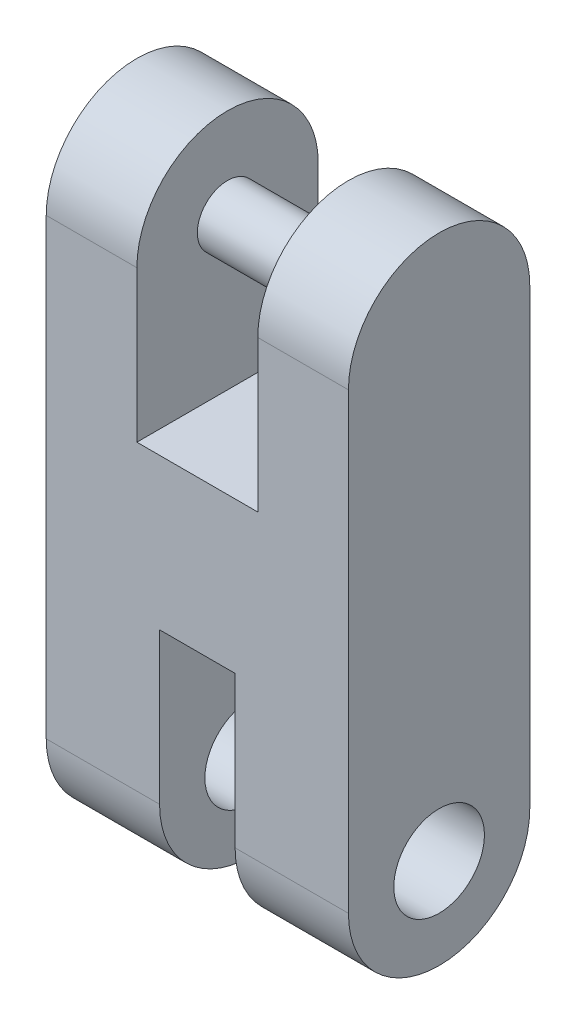
from build123d import *

# Parameters (mm, degrees)
SALIENTE_EXTRUIR1_DEPTH = 6
REDONDEO1_RADIUS        = 3
REDONDEO1_LENGTH        = 3.75
REDONDEO2_RADIUS        = 3
REDONDEO2_LENGTH        = 3
REDONDEO3_RADIUS        = 3
REDONDEO3_LENGTH        = 3
REDONDEO4_RADIUS        = 3
REDONDEO4_LENGTH        = 3.75
CORTAR_EXTRUIR1_REACH   = 26.021
CROQUIS2_R              = 1.5
CROQUIS2_R_2            = 1
SALIENTE_EXTRUIR3_START = -10
CROQUIS6_R              = 1
SALIENTE_EXTRUIR3_DEPTH = 10


with BuildPart() as part:
    # Croquis1 → Saliente-Extruir1 (new body)
    with BuildSketch(Plane.XY):
        Polygon((-7, 21), (-7, 13), (-3, 13), (-3, 21), (0, 21), (0, 0), (-3.75, 0), (-3.75, 8), (-6.25, 8), (-6.25, 0), (-10, 0), (-10, 21), align=None)
    extrude(amount=SALIENTE_EXTRUIR1_DEPTH)

    # Redondeo1: full round fillet: the end face becomes a half cylinder, R = half its width
    redondeo1_face = Plane((-1.875, 0, 3), x_dir=(1, 0, 0), z_dir=(0, -1, 0))  # on the end face: x along it, z out of the body
    redondeo1_slab = redondeo1_face.offset(-REDONDEO1_RADIUS / 2) * Box(REDONDEO1_LENGTH, 2 * REDONDEO1_RADIUS, REDONDEO1_RADIUS, mode=Mode.PRIVATE)  # the body's end, R deep
    redondeo1_round = Plane((-1.875, 3, 3), x_dir=(0, -1, 0), z_dir=(1, 0, 0)) * Cylinder(REDONDEO1_RADIUS, REDONDEO1_LENGTH, mode=Mode.PRIVATE)  # its axis R under the face
    add(redondeo1_slab - redondeo1_round, mode=Mode.SUBTRACT)

    # Redondeo2: full round fillet: the end face becomes a half cylinder, R = half its width
    redondeo2_face = Plane((-1.5, 21, 3), x_dir=(-1, 0, 0), z_dir=(0, 1, 0))  # on the end face: x along it, z out of the body
    redondeo2_slab = redondeo2_face.offset(-REDONDEO2_RADIUS / 2) * Box(REDONDEO2_LENGTH, 2 * REDONDEO2_RADIUS, REDONDEO2_RADIUS, mode=Mode.PRIVATE)  # the body's end, R deep
    redondeo2_round = Plane((-1.5, 18, 3), x_dir=(0, 1, 0), z_dir=(-1, 0, 0)) * Cylinder(REDONDEO2_RADIUS, REDONDEO2_LENGTH, mode=Mode.PRIVATE)  # its axis R under the face
    add(redondeo2_slab - redondeo2_round, mode=Mode.SUBTRACT)

    # Redondeo3: full round fillet: the end face becomes a half cylinder, R = half its width
    redondeo3_face = Plane((-8.5, 21, 3), x_dir=(-1, 0, 0), z_dir=(0, 1, 0))  # on the end face: x along it, z out of the body
    redondeo3_slab = redondeo3_face.offset(-REDONDEO3_RADIUS / 2) * Box(REDONDEO3_LENGTH, 2 * REDONDEO3_RADIUS, REDONDEO3_RADIUS, mode=Mode.PRIVATE)  # the body's end, R deep
    redondeo3_round = Plane((-8.5, 18, 3), x_dir=(0, 1, 0), z_dir=(-1, 0, 0)) * Cylinder(REDONDEO3_RADIUS, REDONDEO3_LENGTH, mode=Mode.PRIVATE)  # its axis R under the face
    add(redondeo3_slab - redondeo3_round, mode=Mode.SUBTRACT)

    # Redondeo4: full round fillet: the end face becomes a half cylinder, R = half its width
    redondeo4_face = Plane((-8.125, 0, 3), x_dir=(1, 0, 0), z_dir=(0, -1, 0))  # on the end face: x along it, z out of the body
    redondeo4_slab = redondeo4_face.offset(-REDONDEO4_RADIUS / 2) * Box(REDONDEO4_LENGTH, 2 * REDONDEO4_RADIUS, REDONDEO4_RADIUS, mode=Mode.PRIVATE)  # the body's end, R deep
    redondeo4_round = Plane((-8.125, 3, 3), x_dir=(0, -1, 0), z_dir=(1, 0, 0)) * Cylinder(REDONDEO4_RADIUS, REDONDEO4_LENGTH, mode=Mode.PRIVATE)  # its axis R under the face
    add(redondeo4_slab - redondeo4_round, mode=Mode.SUBTRACT)

    # Cortar-Extruir1: up to this face of the body (flat: up to its plane)
    cortar_extruir1_end = Plane(part.part.faces().sort_by_distance((-10, 10.5, 3))[0])
    # Croquis2 → Cortar-Extruir1 (cut, up to the picked face)
    with BuildSketch(Plane(origin=(0, 0, 0), x_dir=(0, 0, -1), z_dir=(1, 0, 0)), mode=Mode.PRIVATE) as cortar_extruir1_sk1:
        with Locations((-3, 3)):
            Circle(CROQUIS2_R)
    cortar_extruir1_tool1 = split(extrude(cortar_extruir1_sk1.sketch, amount=-CORTAR_EXTRUIR1_REACH, mode=Mode.PRIVATE), bisect_by=cortar_extruir1_end, keep=Keep.BOTH, mode=Mode.PRIVATE)
    # Croquis2 → Cortar-Extruir1 (cut, up to the picked face)
    with BuildSketch(Plane(origin=(0, 0, 0), x_dir=(0, 0, -1), z_dir=(1, 0, 0)), mode=Mode.PRIVATE) as cortar_extruir1_sk2:
        with Locations(Location((-3, 18, 0), (0, 0, 90))):
            Circle(CROQUIS2_R_2)
    cortar_extruir1_tool2 = split(extrude(cortar_extruir1_sk2.sketch, amount=-CORTAR_EXTRUIR1_REACH, mode=Mode.PRIVATE), bisect_by=cortar_extruir1_end, keep=Keep.BOTH, mode=Mode.PRIVATE)
    add(cortar_extruir1_tool1.solids().sort_by(Axis((0, 3, 3), (-1, 0, 0)))[0], mode=Mode.SUBTRACT)
    add(cortar_extruir1_tool2.solids().sort_by(Axis((0, 18, 3), (-1, 0, 0)))[0], mode=Mode.SUBTRACT)

    # Croquis6 → Saliente-Extruir3 (add)
    with BuildSketch(Plane.ZY.offset(10).offset(SALIENTE_EXTRUIR3_START)):
        with Locations(Location((3, 18, 0), (0, 0, 270))):
            Circle(CROQUIS6_R)
    extrude(amount=SALIENTE_EXTRUIR3_DEPTH)


solid = part.part
